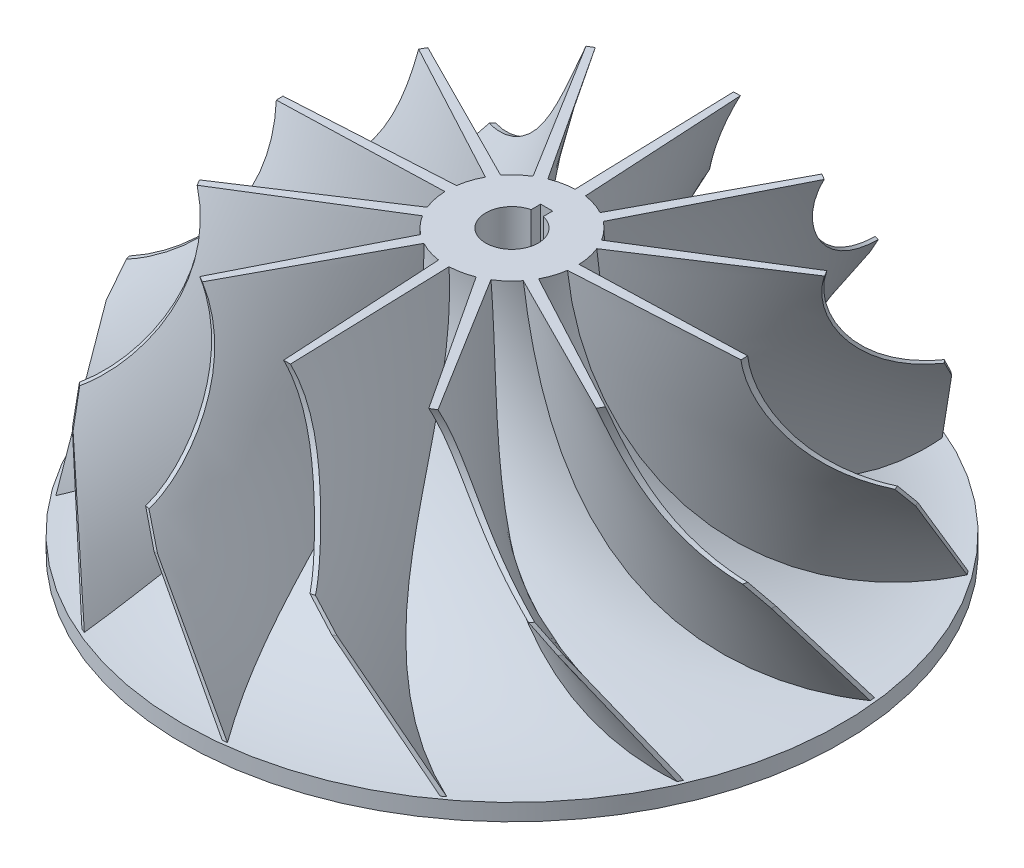
from build123d import *

# Parameters (mm, degrees)
CIRPATTERN1_COUNT  = 12
CUT_EXTRUDE1_DEPTH = 198.61232665062974


with BuildPart() as part:
    # Sketch1 → Revolve1 (revolve)
    with BuildSketch(Plane.XY, mode=Mode.PRIVATE) as revolve1_sk:
        with BuildLine():
            Line((0, 0), (0, 102.10799999999999))
            Line((0, 102.10799999999999), (23.622, 102.10799999999999))
            ThreePointArc((23.622, 102.10799999999999), (51.74326372471718, 34.2172637247172), (119.63399999999999, 6.096))
            Line((119.63399999999999, 6.096), (119.63399999999999, 0))
            Line((119.63399999999999, 0), (0, 0))
        make_face()
    revolve(revolve1_sk.sketch.rotate(Axis((0, 0, 0), (0, 1, 0)), 90), axis=Axis((0, 0, 0), (0, 1, 0)))

    # Sketch4 for Loft1 → Loft1 section 0
    with BuildSketch(Plane.XZ):
        with BuildLine():
            Line((16.889760847632626, 118.43576290339746), (18.635661713905176, 118.18678533638447))
            # circular arc as an exact rational Bezier (weights 1, cos(half-angle), 1)
            Bezier((18.635661713905176, 118.18678533638447), (-24.478077201, 64.070380828), (1.6440594030382032, 0), weights=[1, 0.862844557005, 1])
            Line((1.6440594030382032, 0), (0, 0))
            Bezier((0, 0), (-25.744579373, 64.093535438), (16.889760847632626, 118.43576290339746), weights=[1, 0.866025403784, 1])
        make_face()
    # Sketch5 → Loft1 section 1
    with BuildSketch(Plane(origin=(0, 102.10799999999999, 0), x_dir=(1, 0, 0), z_dir=(0, 1, 0))):
        with BuildLine():
            Line((0, 0), (-4.028502250457766, 2.162025350928317))
            Line((-4.028502250457766, 2.162025350928317), (-57.91121323934574, -104.68326197223229))
            Line((-57.91121323934574, -104.68326197223229), (-56.57299668262428, -105.41247555364485))
            Line((-56.57299668262428, -105.41247555364485), (0, 0))
        make_face()
    loft1 = loft()

    # CirPattern1: Loft1 ×12 about axis
    cirpattern1_axis = Axis((0, 0, 0), (0, -1, 0))
    for i in range(1, CIRPATTERN1_COUNT):
        add(loft1.rotate(cirpattern1_axis, i * 360 / CIRPATTERN1_COUNT))

    # Sketch6 → Cut-Revolve1 (revolve, cut)
    with BuildSketch(Plane.XY, mode=Mode.PRIVATE) as cut_revolve1_sk:
        with BuildLine():
            Line((0, 0), (-8, 0))
            Line((-8, 0), (-122.67055638881486, 0))
            Line((-122.67055638881486, 0), (-122.67055638881486, 11.768598741879272))
            Line((-122.67055638881486, 11.768598741879272), (-111.10294401086443, 56.62277511412192))
            ThreePointArc((-111.10294401086443, 56.62277511412192), (-85.85401660275737, 74.40858003095448), (-84.15391369139391, 105.24610330845293))
            Line((-84.15391369139391, 105.24610330845293), (-23.080668939145205, 105.24610330845294))
            Line((-23.080668939145205, 105.24610330845294), (-23.080668939145205, 102.10799999999999))
            Line((-23.080668939145205, 102.10799999999999), (0, 102.10799999999999))
            Line((0, 102.10799999999999), (0, 124.45248457681545))
            Line((0, 124.45248457681545), (-130.82468745566533, 124.45248457681542))
            Line((-130.82468745566533, 124.45248457681542), (-130.82468745566533, -8.728398960341249))
            Line((-130.82468745566533, -8.728398960341249), (0, -8.728398960341249))
            Line((0, -8.728398960341249), (0, 0))
        make_face()
    revolve(cut_revolve1_sk.sketch.rotate(Axis((0, 0, 0), (0, 1, 0)), 270), axis=Axis((0, 0, 0), (0, 1, 0)), mode=Mode.SUBTRACT)

    # Sketch10 → Cut-Extrude1 (cut, through all)
    with BuildSketch(Plane(origin=(0, 102.10799999999999, 0), x_dir=(1, 0, 0), z_dir=(0, 1, 0))):
        with BuildLine():
            Line((-2.286, 12.7), (2.0646078793227622, 12.7))
            Line((2.0646078793227622, 12.7), (2.0646078793227627, 9.298549311835606))
            ThreePointArc((2.0646078793227627, 9.298549311835606), (0.11370134191629981, -9.524321340906473), (-2.286, 9.24661175782784))
            Line((-2.286, 9.24661175782784), (-2.286, 12.7))
        make_face()
    extrude(amount=-CUT_EXTRUDE1_DEPTH, mode=Mode.SUBTRACT)


solid = part.part
